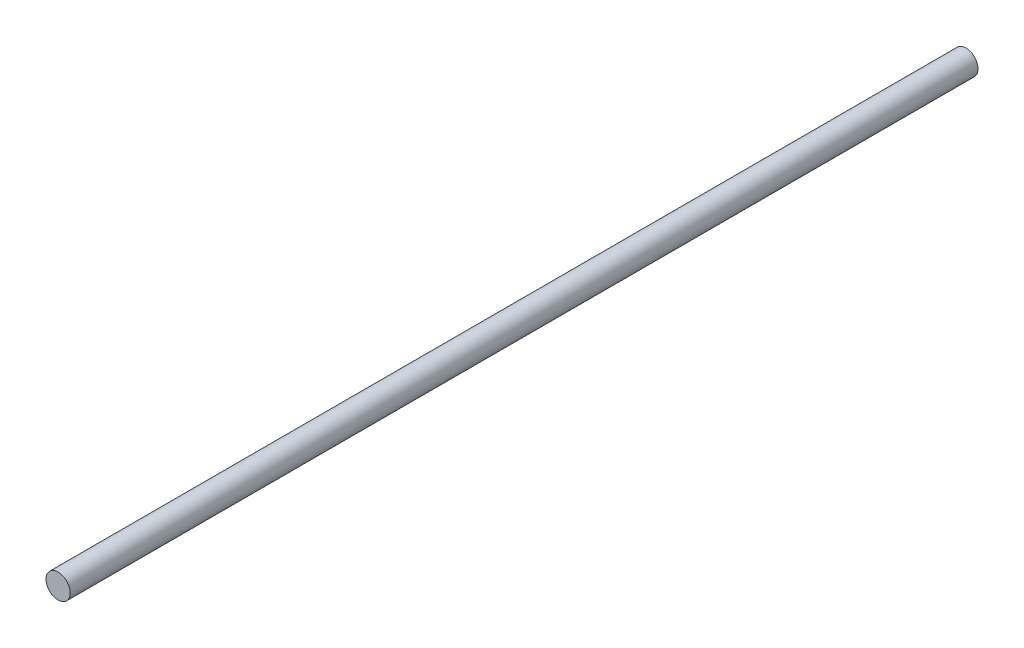
from build123d import *

# Parameters (mm, degrees)
SKETCH_1_R      = 1
EXTRUDE_1_DEPTH = 37.5


with BuildPart() as part:
    # 草图1 → 凸台-拉伸1 (new, symmetric)
    with BuildSketch(Plane.XY):
        Circle(SKETCH_1_R)
    extrude(amount=EXTRUDE_1_DEPTH, both=True)


solid = part.part
